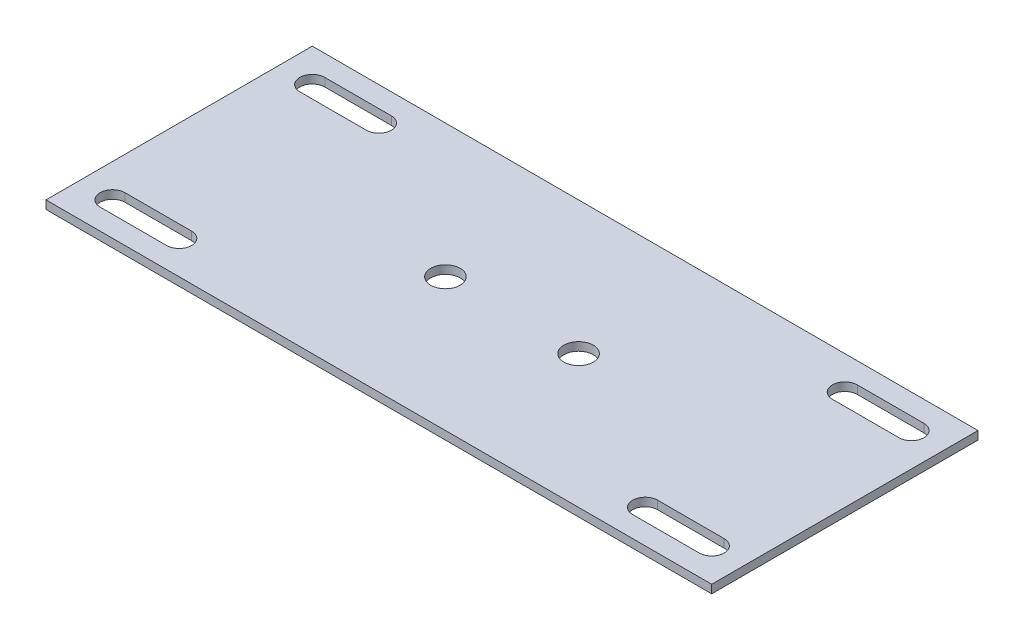
from build123d import *

# Parameters (mm, degrees)
SKETCH1_W              = 127
SKETCH1_H              = 50.8
BOSS_EXTRUDE1_DEPTH    = 1.5875
SKETCH2_R              = 1.27
CUT_EXTRUDE1_DEPTH     = 69.410015029
F_10_CLEARANCE_HOLE1_D = 5.6134


with BuildPart() as part:
    # Sketch1 → Boss-Extrude1 (new body)
    with BuildSketch(Plane(origin=(0, 0, 0), x_dir=(1, 0, 0), z_dir=(0, 1, 0))):
        Rectangle(SKETCH1_W, SKETCH1_H)
    extrude(amount=BOSS_EXTRUDE1_DEPTH)

    # Sketch2 → Cut-Extrude1 (cut, through all)
    with BuildSketch(Plane(origin=(0, 1.5875, 0), x_dir=(1, 0, 0), z_dir=(0, 1, 0))):
        with Locations(Location((-12.7, 0, 0), (0, 0, 270))):
            Circle(SKETCH2_R)
        with Locations(Location((12.7, 0, 0), (0, 0, 270))):
            Circle(SKETCH2_R)
        with BuildLine():
            Line((-57.15, 16.66875), (-44.45, 16.66875))
            ThreePointArc((-44.45, 16.66875), (-42.06875, 19.05), (-44.45, 21.43125))
            Line((-44.45, 21.43125), (-57.15, 21.43125))
            ThreePointArc((-57.15, 21.43125), (-59.53125, 19.05), (-57.15, 16.66875))
        make_face()
        with BuildLine():
            Line((-57.15, -21.43125), (-44.45, -21.43125))
            ThreePointArc((-44.45, -21.43125), (-42.06875, -19.05), (-44.45, -16.66875))
            Line((-44.45, -16.66875), (-57.15, -16.66875))
            ThreePointArc((-57.15, -16.66875), (-59.53125, -19.05), (-57.15, -21.43125))
        make_face()
        with BuildLine():
            Line((44.45, 16.66875), (57.15, 16.66875))
            ThreePointArc((57.15, 16.66875), (59.53125, 19.05), (57.15, 21.43125))
            Line((57.15, 21.43125), (44.45, 21.43125))
            ThreePointArc((44.45, 21.43125), (42.06875, 19.05), (44.45, 16.66875))
        make_face()
        with BuildLine():
            Line((44.45, -21.43125), (57.15, -21.43125))
            ThreePointArc((57.15, -21.43125), (59.53125, -19.05), (57.15, -16.66875))
            Line((57.15, -16.66875), (44.45, -16.66875))
            ThreePointArc((44.45, -16.66875), (42.06875, -19.05), (44.45, -21.43125))
        make_face()
    extrude(amount=-CUT_EXTRUDE1_DEPTH, mode=Mode.SUBTRACT)

    # #10 Clearance Hole1 (through all)
    with Locations(Plane(origin=(0, 1.5875, 0), x_dir=(1, 0, 0), z_dir=(0, 1, 0))):
        with Locations((-12.7, 0), (12.7, 0)):
            Hole(F_10_CLEARANCE_HOLE1_D / 2)


solid = part.part
